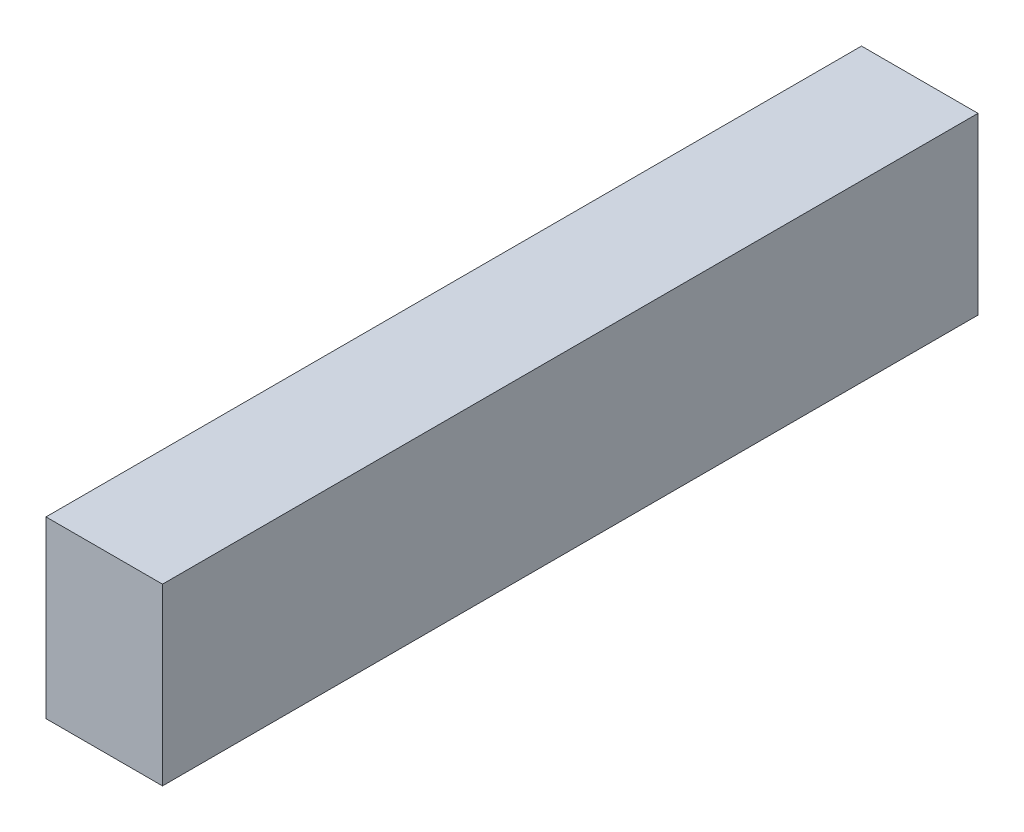
from build123d import *

# Parameters (mm, degrees)
PRESS_UC_PENCE_PARMAK_2_1_START = -160
SKETCH1_W                       = 20
SKETCH1_H                       = 30
PRESS_UC_PENCE_PARMAK_2_1_DEPTH = 140


with BuildPart() as part:
    # Sketch1 → PRESS_uc_pence_parmak_2_1 (new body)
    with BuildSketch(Plane.XY.offset(PRESS_UC_PENCE_PARMAK_2_1_START)):
        with Locations((180, 1269)):
            Rectangle(SKETCH1_W, SKETCH1_H)
    extrude(amount=-PRESS_UC_PENCE_PARMAK_2_1_DEPTH)


solid = part.part
